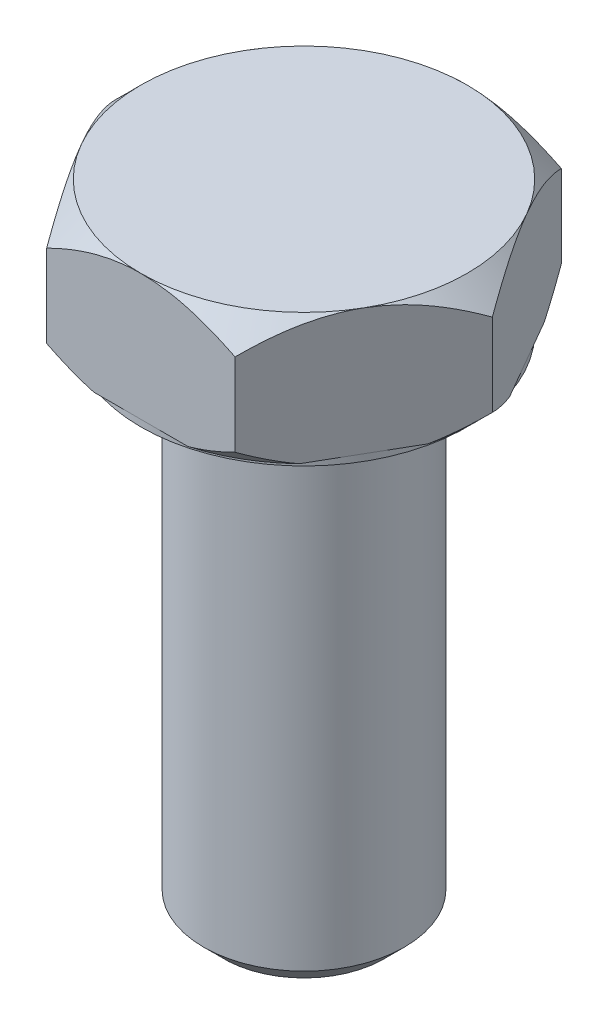
from build123d import *

# Parameters (mm, degrees)
BOSS_EXTRUDE1_DEPTH = 5.3
SKETCH2_OUTSIDE_W   = 21.122
SKETCH2_OUTSIDE_H   = 19.11
SKETCH2_OUTSIDE_R   = 6.5
CUT_EXTRUDE1_DEPTH  = 0.265
SKETCH3_R           = 4
BOSS_EXTRUDE2_DEPTH = 20
CHAMFER1_SIZE       = 0.8


with BuildPart() as part:
    # Sketch1 → Boss-Extrude1 (new body)
    with BuildSketch(Plane(origin=(0, 0, 0), x_dir=(1, 0, 0), z_dir=(0, 1, 0))):
        Polygon((7.505553499, 0), (3.75277675, 6.5), (-3.75277675, 6.5), (-7.505553499, 0), (-3.75277675, -6.5), (3.75277675, -6.5), align=None)
    extrude(amount=-BOSS_EXTRUDE1_DEPTH)

    # Sketch4 → Cut-Revolve1 (revolve, cut)
    with BuildSketch(Plane(origin=(0, 0, 0), x_dir=(0, 0, -1), z_dir=(1, 0, 0))):
        Polygon((-6.5, 0), (-8.15, 0), (-8.15, -1.65), align=None)
        Polygon((-8.15, -3.65), (-6.5, -5.3), (-8.15, -5.3), align=None)
    revolve(axis=Axis((0, 0, 0), (0, -1, 0)), mode=Mode.SUBTRACT)

    # Sketch2 outside → Cut-Extrude1 (cut)
    with BuildSketch(Plane.XZ.offset(5.3)):
        Rectangle(SKETCH2_OUTSIDE_W, SKETCH2_OUTSIDE_H)
        with Locations(Location((0, 0, 0), (0, 0, 90))):
            Circle(SKETCH2_OUTSIDE_R, mode=Mode.SUBTRACT)
    extrude(amount=-CUT_EXTRUDE1_DEPTH, mode=Mode.SUBTRACT)

    # Sketch3 → Boss-Extrude2 (add)
    with BuildSketch(Plane.XZ.offset(5.3)):
        with Locations(Location((0, 0, 0), (0, 0, 90))):
            Circle(SKETCH3_R)
    extrude(amount=BOSS_EXTRUDE2_DEPTH)

    # Chamfer1
    chamfer1_edges = [part.edges().sort_by_distance(p)[0] for p in [
        (0, -25.3, -4),
    ]]
    chamfer(chamfer1_edges, length=CHAMFER1_SIZE)


solid = part.part
